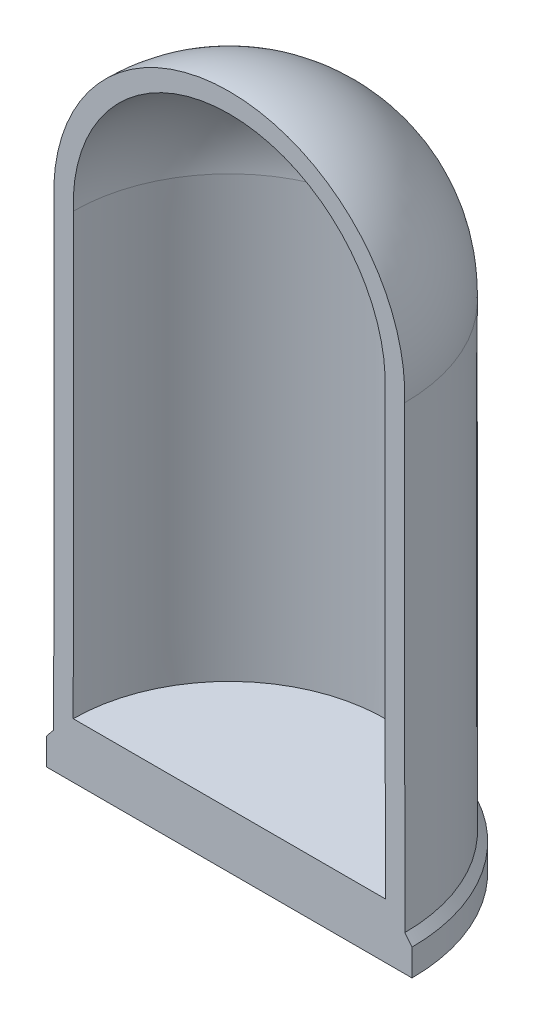
from build123d import *

# Parameters (mm, degrees)
REVOLVE6_ANGLE = 180


with BuildPart() as part:
    # Sketch1 → Revolve6 (revolve)
    with BuildSketch(Plane.XY):
        with BuildLine():
            Line((175, 0), (0, 0))
            Line((0, 0), (0, -61.875))
            Line((0, -61.875), (205, -61.875))
            Line((205, -61.875), (205, -31.875))
            Line((205, -31.875), (196.880944781, -21.875))
            Line((196.880944781, -21.875), (196.741111153, 492.740467835))
            ThreePointArc((196.741111153, 492.740467835), (141.755045801, 636.620908411), (0, 696.875))
            Line((0, 696.875), (0, 675))
            ThreePointArc((0, 675), (126.141271645, 621.298720471), (174.865998275, 493.152909575))
            Line((174.865998275, 493.152909575), (175, 0))
        make_face()
    revolve(axis=Axis((0, 914.773331767, 0), (0, 1, 0)), revolution_arc=REVOLVE6_ANGLE)


solid = part.part
